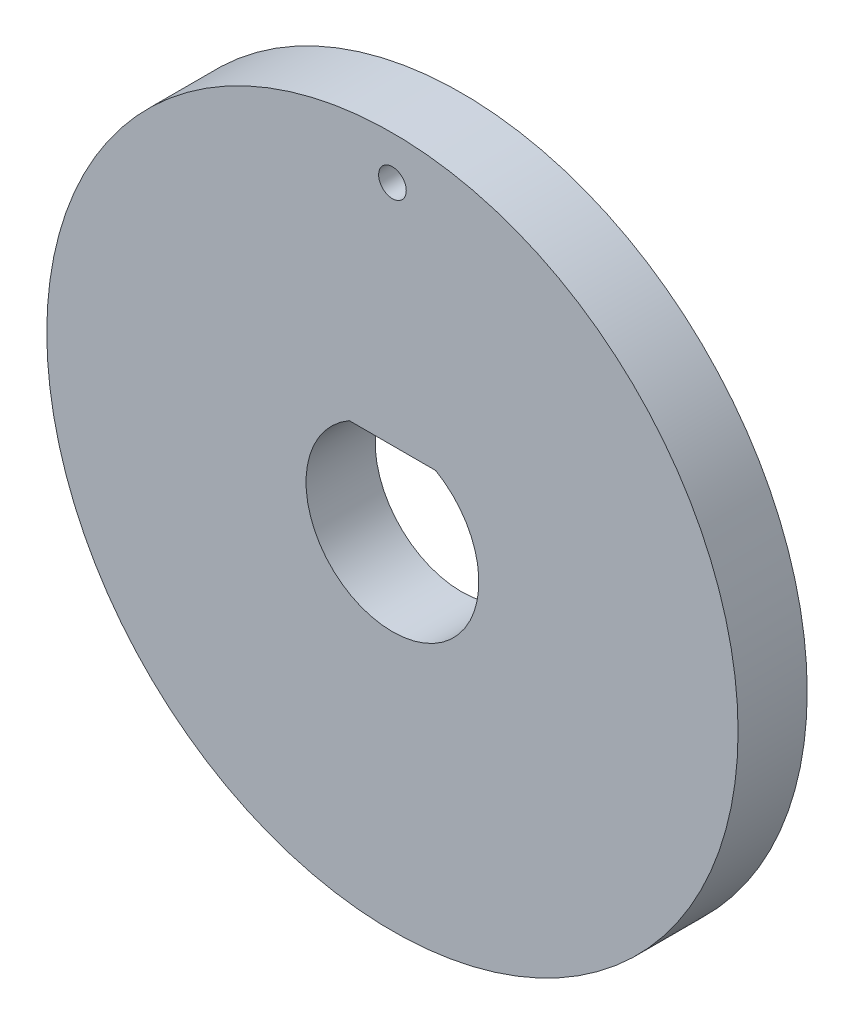
from build123d import *

# Parameters (mm, degrees)
SKETCH2_R           = 12.7
SKETCH2_R_2         = 0.508
BOSS_EXTRUDE1_DEPTH = 2.54


with BuildPart() as part:
    # Sketch2 → Boss-Extrude1 (new body)
    with BuildSketch(Plane.XY):
        Circle(SKETCH2_R)
        with Locations((0, 11.1125)):
            Circle(SKETCH2_R_2, mode=Mode.SUBTRACT)
        with BuildLine():
            Line((-1.5875, 2.749630657), (1.5875, 2.749630657))
            ThreePointArc((1.5875, 2.749630657), (0, -3.175), (-1.5875, 2.749630657))
        make_face(mode=Mode.SUBTRACT)
    extrude(amount=BOSS_EXTRUDE1_DEPTH)


solid = part.part
